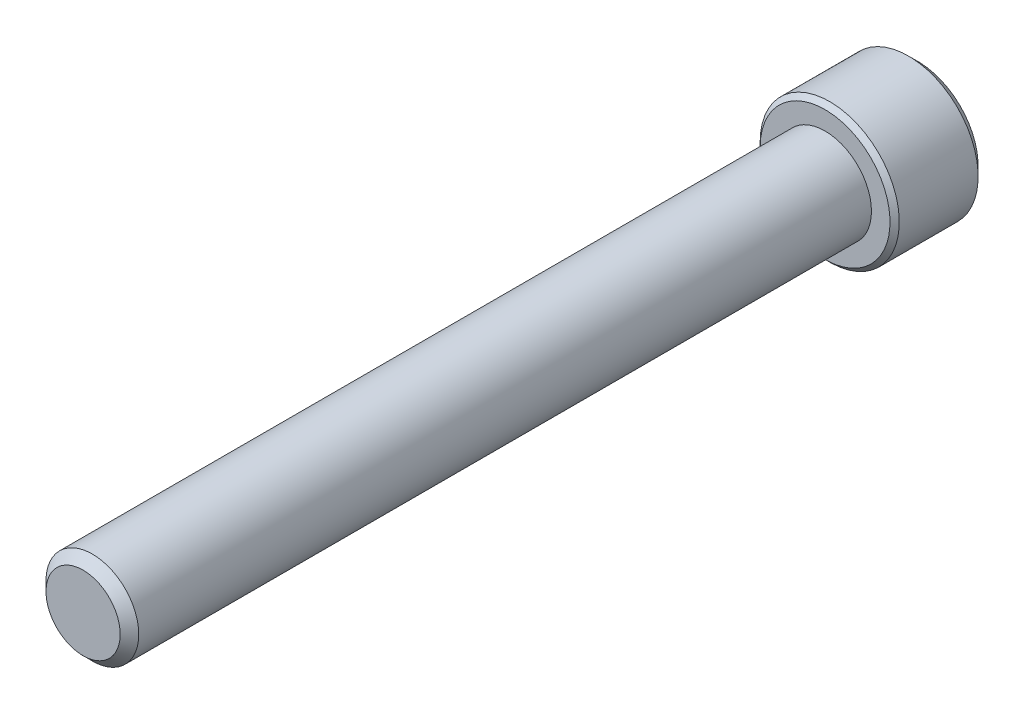
from build123d import *

# Parameters (mm, degrees)
SKETCH1_R          = 3.96875
EXTRUDE1_DEPTH     = 63.5
CHAMFER3_SIZE      = 0.79375
SKETCH6_R          = 5.953125
EXTRUDE2_DEPTH     = 7.9375
CUT_EXTRUDE1_DEPTH = 4.7625
SKETCH8_R          = 3.666174209
CUT_EXTRUDE2_DEPTH = 0.79375
CUT_EXTRUDE2_DRAFT = -45
CHAMFER1_SIZE      = 0.79375
CHAMFER2_SIZE      = 0.396875


with BuildPart() as part:
    # Sketch1 → Extrude1 (new body)
    with BuildSketch(Plane.XY):
        Circle(SKETCH1_R)
    extrude(amount=-EXTRUDE1_DEPTH)

    # Chamfer3
    chamfer3_edges = [part.edges().sort_by_distance(p)[0] for p in [
        (-3.96875, 0, 0),
    ]]
    chamfer(chamfer3_edges, length=CHAMFER3_SIZE)

    # Sketch5 → partially thread (revolve)
    with BuildSketch(Plane(origin=(0, 0, 0), x_dir=(0, 0, -1), z_dir=(1, 0, 0))):
        Polygon((63.5, 3.96875), (28.575, 3.96875), (24.60625, 0), (28.575, 0), (63.5, 0), align=None)
    revolve(axis=Axis((0, 0, 0), (0, 0, -1)))

    # Sketch6 → Extrude2 (add)
    with BuildSketch(Plane(origin=(0, 0, -63.5), x_dir=(-1, 0, 0), z_dir=(0, 0, -1))):
        Circle(SKETCH6_R)
    extrude(amount=EXTRUDE2_DEPTH)

    # Sketch7 → Cut-Extrude1 (cut)
    with BuildSketch(Plane(origin=(0, 0, -71.4375), x_dir=(-1, 0, 0), z_dir=(0, 0, -1))):
        Polygon((0, 3.666174209), (-3.175, 1.833087105), (-3.175, -1.833087105), (0, -3.666174209), (3.175, -1.833087105), (3.175, 1.833087105), align=None)
    extrude(amount=-CUT_EXTRUDE1_DEPTH, mode=Mode.SUBTRACT)


with BuildPart() as cut_extrude2_tool:
    # Sketch8 → Cut-Extrude2 (with draft: the straight prism first)
    with BuildSketch(Plane(origin=(0, 0, -71.4375), x_dir=(-1, 0, 0), z_dir=(0, 0, -1))):
        Circle(SKETCH8_R)
    extrude(amount=-CUT_EXTRUDE2_DEPTH)
    # Cut-Extrude2: the draft: its side faces are tilted about the plane it starts from
    cut_extrude2_sides = [cut_extrude2_tool.faces().sort_by_distance(p)[0] for p in [
        (3.666174209, 0, -71.040625),
    ]]
    draft(cut_extrude2_sides, Plane(origin=(0, 0, -71.4375), x_dir=(-1, 0, 0), z_dir=(0, 0, -1)), CUT_EXTRUDE2_DRAFT)


with BuildPart() as part_1:
    add(part.part)

    # Cut-Extrude2: cut by cut_extrude2_tool
    add(cut_extrude2_tool.part, mode=Mode.SUBTRACT)

    # Chamfer1
    chamfer1_edges = [part_1.edges().sort_by_distance(p)[0] for p in [
        (5.953125, 0, -71.4375),
    ]]
    chamfer(chamfer1_edges, length=CHAMFER1_SIZE)

    # Chamfer2
    chamfer2_edges = [part_1.edges().sort_by_distance(p)[0] for p in [
        (5.953125, 0, -63.5),
    ]]
    chamfer(chamfer2_edges, length=CHAMFER2_SIZE)


solid = part_1.part
